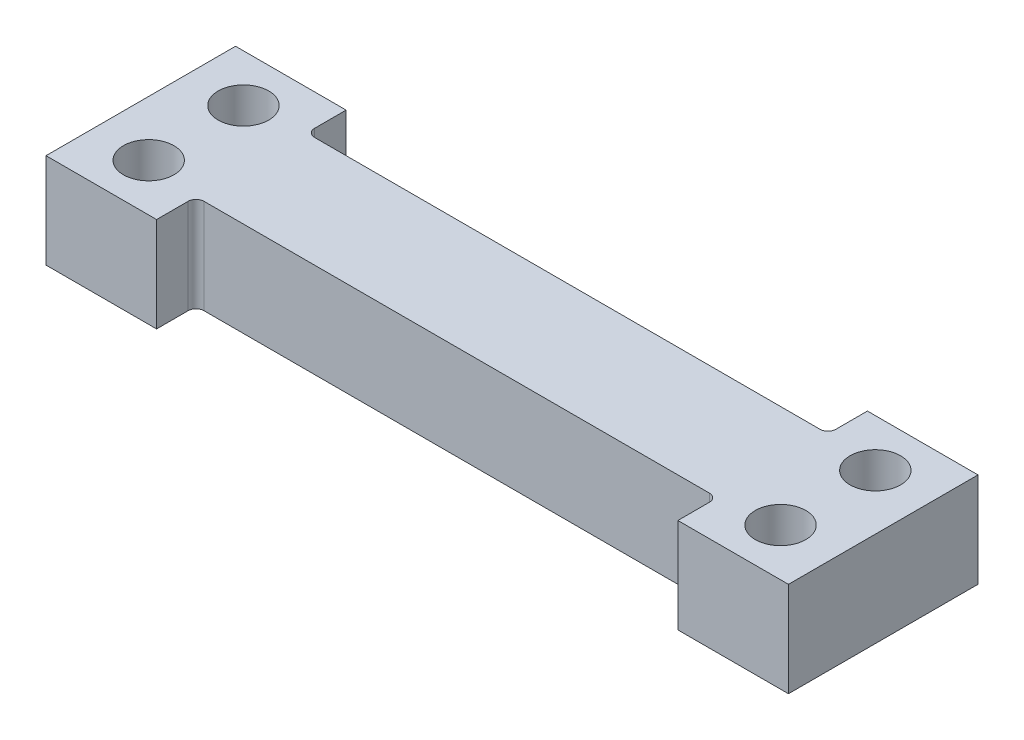
from build123d import *

# Parameters (mm, degrees)
SKETCH1_R           = 1.6
BOSS_EXTRUDE1_DEPTH = 6
FILLET1_R           = 0.5


with BuildPart() as part:
    # Sketch1 → Boss-Extrude1 (new body)
    with BuildSketch(Plane(origin=(0, 0, 0), x_dir=(1, 0, 0), z_dir=(0, 1, 0))):
        Polygon((0, 0), (0, 12), (7, 12), (7, 9.5), (40, 9.5), (40, 12), (47, 12), (47, 0), (40, 0), (40, 2.5), (7, 2.5), (7, 0), align=None)
        with Locations(Location((3.5, 9, 0), (0, 0, 270))):
            Circle(SKETCH1_R, mode=Mode.SUBTRACT)
        with Locations(Location((3.5, 3, 0), (0, 0, 270))):
            Circle(SKETCH1_R, mode=Mode.SUBTRACT)
        with Locations(Location((43.5, 3, 0), (0, 0, 90))):
            Circle(SKETCH1_R, mode=Mode.SUBTRACT)
        with Locations(Location((43.5, 9, 0), (0, 0, 90))):
            Circle(SKETCH1_R, mode=Mode.SUBTRACT)
    extrude(amount=BOSS_EXTRUDE1_DEPTH)

    # Fillet1
    fillet1_edges = [part.edges().sort_by_distance(p)[0] for p in [
        (7, 3, -9.5),
        (40, 3, -9.5),
        (40, 3, -2.5),
        (7, 3, -2.5),
    ]]
    fillet(fillet1_edges, radius=FILLET1_R)


solid = part.part
